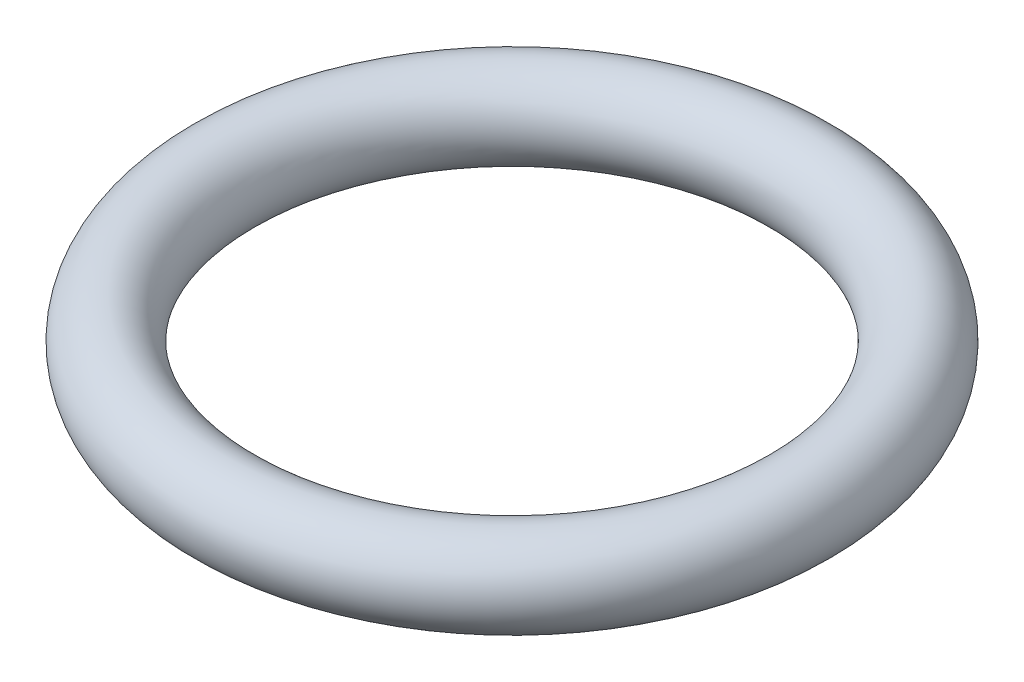
from build123d import *

# Parameters (mm, degrees)
SKETCH1_R = 0.79375


with BuildPart() as part:
    # Sketch1 → Revolve1 (revolve)
    with BuildSketch(Plane.XY):
        with Locations((5.3848, 0)):
            Circle(SKETCH1_R)
    revolve(axis=Axis((0, -146.128692455, 0), (0, 1, 0)))


solid = part.part
